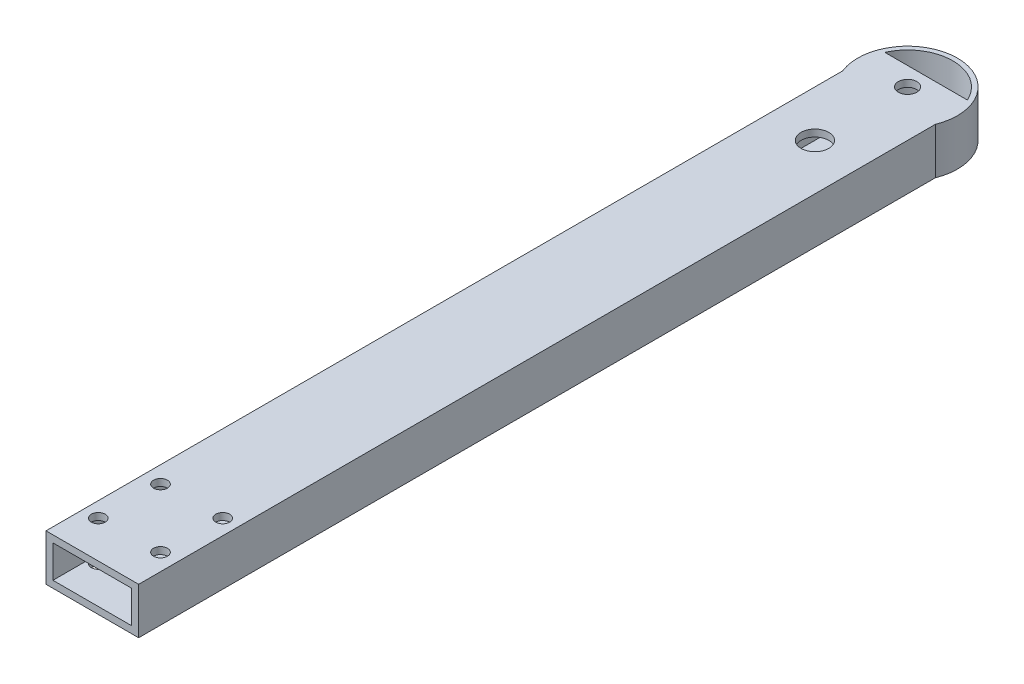
from build123d import *

# Parameters (mm, degrees)
SKETCH1_W           = 20
SKETCH1_H           = 10
SKETCH1_W_2         = 17
SKETCH1_H_2         = 7
BOSS_EXTRUDE1_DEPTH = 180
SKETCH2_R           = 1.5
CUT_EXTRUDE1_DEPTH  = 181.554700853
SKETCH3_R           = 2
SKETCH3_R_2         = 3
CUT_EXTRUDE2_DEPTH  = 181.554700853
SKETCH5_R           = 10.770329614
SKETCH5_R_2         = 9.770329614
BOSS_EXTRUDE2_DEPTH = 10


with BuildPart() as part:
    # Sketch1 → Boss-Extrude1 (new body)
    with BuildSketch(Plane.XY):
        Rectangle(SKETCH1_W, SKETCH1_H)
        Rectangle(SKETCH1_W_2, SKETCH1_H_2, mode=Mode.SUBTRACT)
    extrude(amount=BOSS_EXTRUDE1_DEPTH)

    # Sketch2 → Cut-Extrude1 (cut, through all)
    with BuildSketch(Plane(origin=(0, 5, 0), x_dir=(1, 0, 0), z_dir=(0, 1, 0))):
        with Locations((6.363961031, -171.646446609)):
            Circle(SKETCH2_R)
        with Locations((-6.717514421, -172)):
            Circle(SKETCH2_R)
        with Locations((6.717514421, -158.564971157)):
            Circle(SKETCH2_R)
        with Locations((-6.363961031, -158.918524548)):
            Circle(SKETCH2_R)
    extrude(amount=-CUT_EXTRUDE1_DEPTH, mode=Mode.SUBTRACT)

    # Sketch3 → Cut-Extrude2 (cut, through all)
    with BuildSketch(Plane(origin=(0, 5, 0), x_dir=(1, 0, 0), z_dir=(0, 1, 0))):
        with Locations((0, -4)):
            Circle(SKETCH3_R)
        with Locations((0, -24)):
            Circle(SKETCH3_R_2)
    extrude(amount=-CUT_EXTRUDE2_DEPTH, mode=Mode.SUBTRACT)

    # Sketch5 → Boss-Extrude2 (add)
    with BuildSketch(Plane(origin=(0, 5, 0), x_dir=(1, 0, 0), z_dir=(0, 1, 0))):
        with Locations((0, -4)):
            Circle(SKETCH5_R)
        with Locations((0, -4)):
            Circle(SKETCH5_R_2, mode=Mode.SUBTRACT)
    extrude(amount=-BOSS_EXTRUDE2_DEPTH)


solid = part.part
